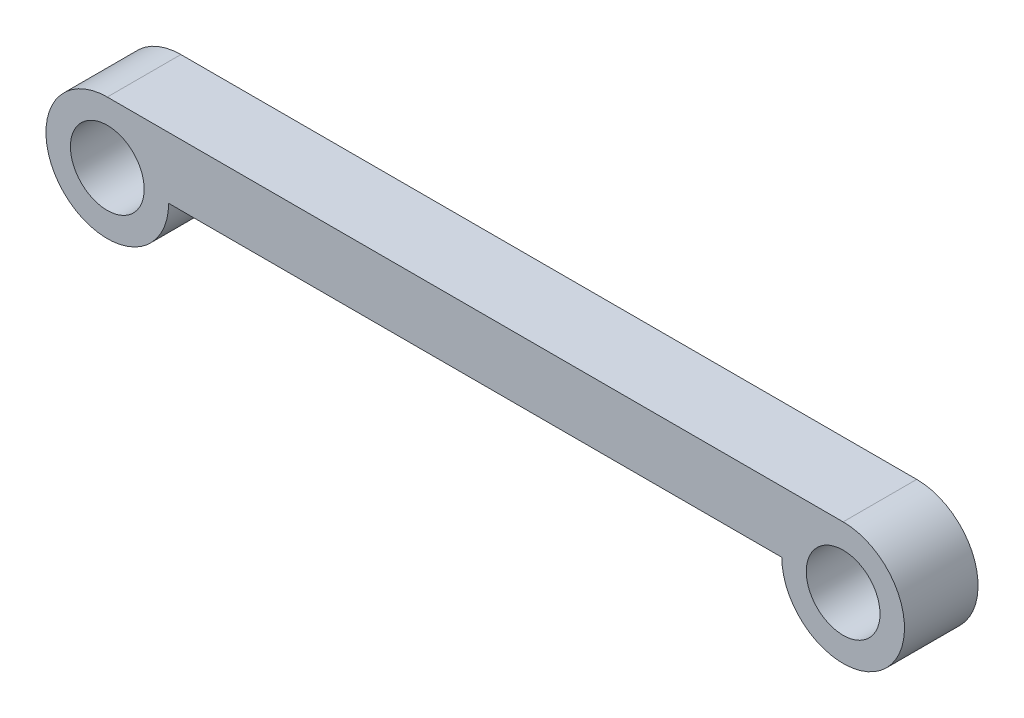
from build123d import *

# Parameters (mm, degrees)
SKETCH_1_R      = 1.503661285
SKETCH_1_R_2    = 1.504036587
EXTRUDE_1_DEPTH = 3


with BuildPart() as part:
    # 草图1 → 凸台-拉伸1 (new body)
    with BuildSketch(Plane.XY):
        with BuildLine():
            Line((0, 0), (15.002289805, 0))
            ThreePointArc((15.002289805, 0), (16.770627342, -4.269144464), (12.501482877, -2.500806927))
            Line((12.501482877, -2.500806927), (-12.497361882, -2.500806927))
            ThreePointArc((-12.497361882, -2.500806927), (-16.766506346, -4.269144464), (-14.998168809, 0))
            Line((-14.998168809, 0), (0, 0))
        make_face()
        with Locations((-14.998168809, -2.500806927)):
            Circle(SKETCH_1_R, mode=Mode.SUBTRACT)
        with Locations((15.002289805, -2.500806927)):
            Circle(SKETCH_1_R_2, mode=Mode.SUBTRACT)
    extrude(amount=EXTRUDE_1_DEPTH)


solid = part.part
